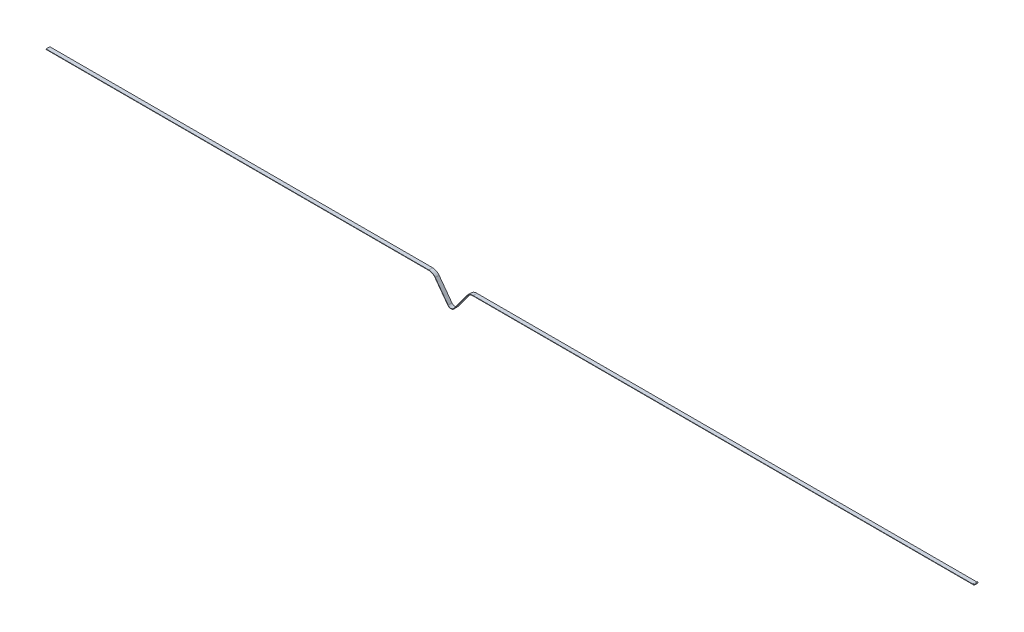
from build123d import *

# Parameters (mm, degrees)
SKETCH1_W           = 6
SKETCH1_H           = 0.63
BOSS_EXTRUDE1_DEPTH = 6


with BuildPart() as part:
    # Sweep1: sweep along a path in Sketch2
    with BuildLine(Plane.XY) as sweep1_path:
        Line((0, 0), (-781.58134885, 0))
        ThreePointArc((-781.58134885, 0), (-786.980015756, -1.28900119), (-791.214015204, -4.877925416))
        Line((-791.214015204, -4.877925416), (-811.226194756, -32.135931022))
        ThreePointArc((-811.226194756, -32.135931022), (-816.15134885, -34.63), (-821.076502944, -32.135931022))
        Line((-821.076502944, -32.135931022), (-841.088682496, -4.877925416))
        ThreePointArc((-841.088682496, -4.877925416), (-845.322681944, -1.28900119), (-850.72134885, 0))
        Line((-850.72134885, 0), (-1447.8, 0))
    # Sketch1 → Sweep1 (sweep)
    with BuildSketch(Plane(origin=(0, 0, 0), x_dir=(0, 0, -1), z_dir=(1, 0, 0))):
        with Locations((3, 0.315)):
            Rectangle(SKETCH1_W, SKETCH1_H)
    sweep(path=sweep1_path.line)

    # Sketch3 → Boss-Extrude1 (add, through all)
    with BuildSketch(Plane.XY):
        with BuildLine():
            Line((-1.5, 0.63), (-1.5, 0))
            Line((-1.5, 0), (0, 0))
            Line((0, 0), (0, 0.63))
            ThreePointArc((0, 0.63), (-0.75, 1.38), (-1.5, 0.63))
        make_face()
    extrude(amount=-BOSS_EXTRUDE1_DEPTH)


solid = part.part
